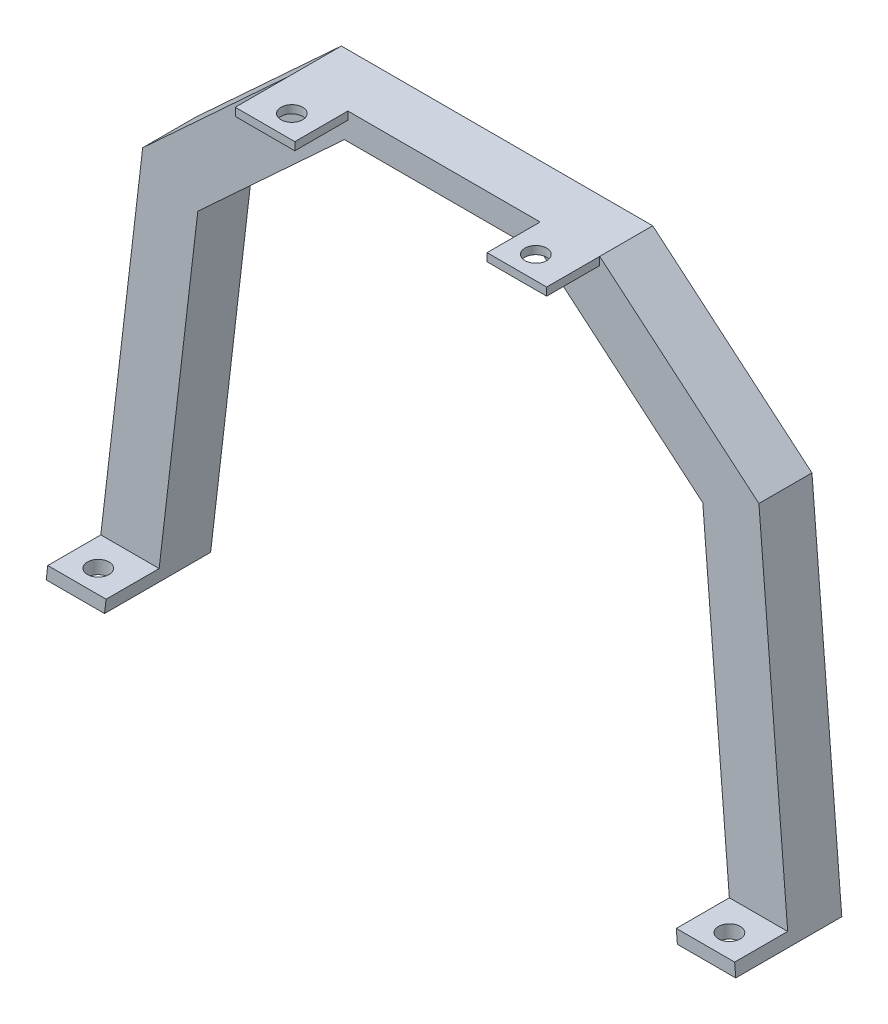
from build123d import *

# Parameters (mm, degrees)
BOSS_EXTRUDE1_DEPTH = 10
BOSS_EXTRUDE2_DEPTH = 10
SKETCH3_R           = 2.05
CUT_EXTRUDE1_DEPTH  = 10
SKETCH4_W           = 11.229416436
SKETCH4_H           = 1.5
BOSS_EXTRUDE3_DEPTH = 10
SKETCH6_R           = 2.05
CUT_EXTRUDE2_DEPTH  = 10


with BuildPart() as part:
    # Sketch1 → Boss-Extrude1 (new body)
    with BuildSketch(Plane.XY):
        Polygon((0, 0), (-11, 0), (-2.811023481, 69.662685047), (24.646347311, 95), (83.353652689, 95), (113.374131029, 69.662685047), (119, 0), (108, 0), (102.791775395, 64.491176779), (72.568088456, 90), (35.224285945, 90), (7.581056228, 64.491176779), align=None)
    extrude(amount=BOSS_EXTRUDE1_DEPTH)

    # Sketch2 → Boss-Extrude2 (add)
    with BuildSketch(Plane.XY.offset(10)):
        Polygon((-11, 0), (0, 0), (0.29387959, 2.5), (-10.70612041, 2.5), align=None)
        Polygon((108, 0), (119, 0), (118.798103211, 2.5), (107.798103211, 2.5), align=None)
    extrude(amount=BOSS_EXTRUDE2_DEPTH)

    # Sketch3 → Cut-Extrude1 (cut)
    with BuildSketch(Plane(origin=(0, 2.5, 0), x_dir=(1, 0, 0), z_dir=(0, 1, 0))):
        with Locations(Location((-5.5, -15.687372709, 0), (0, 0, 180))):
            Circle(SKETCH3_R)
        with Locations(Location((113.5, -15.687372709, 0), (0, 0, 180))):
            Circle(SKETCH3_R)
    extrude(amount=-CUT_EXTRUDE1_DEPTH, mode=Mode.SUBTRACT)

    # Sketch4 → Boss-Extrude3 (add)
    with BuildSketch(Plane.XY.offset(10)):
        with Locations((30.261055529, 94.25)):
            Rectangle(SKETCH4_W, SKETCH4_H)
        with Locations((77.738944471, 94.25)):
            Rectangle(SKETCH4_W, SKETCH4_H)
    extrude(amount=BOSS_EXTRUDE3_DEPTH)

    # Sketch6 → Cut-Extrude2 (cut)
    with BuildSketch(Plane(origin=(0, 95, 0), x_dir=(1, 0, 0), z_dir=(0, 1, 0))):
        with Locations(Location((31, -15.687372709, 0), (0, 0, 270))):
            Circle(SKETCH6_R)
        with Locations(Location((77, -15.687372709, 0), (0, 0, 270))):
            Circle(SKETCH6_R)
    extrude(amount=-CUT_EXTRUDE2_DEPTH, mode=Mode.SUBTRACT)


solid = part.part
